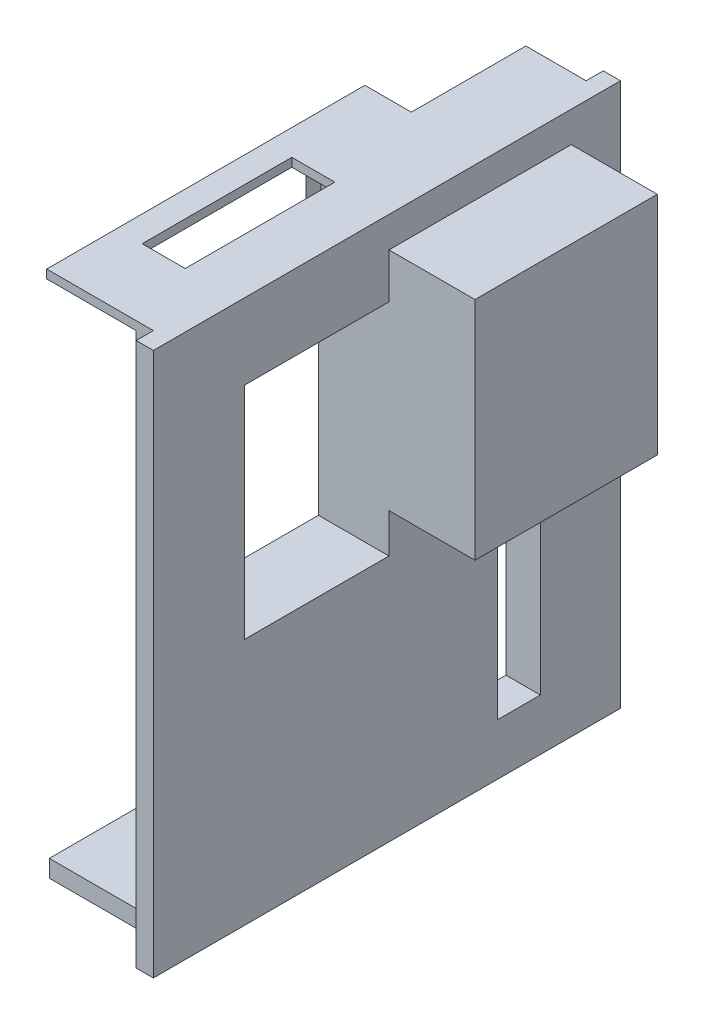
from build123d import *

# Parameters (mm, degrees)
SKETCH1_W            = 68.987924
SKETCH1_H            = 80.264
BOSS_EXTRUDE3_DEPTH  = 2.54
SKETCH1_7_W          = 63.907924
SKETCH1_7_H          = 77.724
BOSS_EXTRUDE4_DEPTH  = 2.54
SKETCH1_9_W          = 46.99
SKETCH1_9_H          = 1.27
BOSS_EXTRUDE6_DEPTH  = 15.748
SKETCH2_W            = 6.35
SKETCH2_H            = 22.098
CUT_EXTRUDE1_DEPTH   = 2.54
SKETCH3_W            = 16.917924
SKETCH3_H            = 1.27
BOSS_EXTRUDE7_DEPTH  = 6.35
SKETCH4_W            = 21.336
SKETCH4_H            = 32.512
CUT_EXTRUDE2_DEPTH   = 5.08
SKETCH5_W            = 25.4
SKETCH5_H            = 31.75
CUT_EXTRUDE3_DEPTH   = 5.08
SKETCH5_3_W          = 26.924
SKETCH5_3_H          = 33.34449199
SKETCH5_3_W_2        = 25.4
SKETCH5_3_H_2        = 31.75
BOSS_EXTRUDE8_DEPTH  = 12.7
BOSS_EXTRUDE9_START  = 12.7
SKETCH5_4_W          = 25.4
SKETCH5_4_H          = 31.75
BOSS_EXTRUDE9_DEPTH  = 1.27
SKETCH7_W            = 22.86
SKETCH7_H            = 34.036
SKETCH7_W_2          = 21.336
SKETCH7_H_2          = 32.512
BOSS_EXTRUDE10_DEPTH = 5.334
SKETCH6_W            = 6.35
SKETCH6_H            = 33.02
CUT_EXTRUDE5_DEPTH   = 5.334
SKETCH9_W            = 43.18
SKETCH9_H            = 2.54
BOSS_EXTRUDE12_DEPTH = 12.827
SKETCH10_W           = 2.54
SKETCH10_H           = 8.128
BOSS_EXTRUDE13_DEPTH = 32.258
BOSS_EXTRUDE14_DEPTH = 8.128


with BuildPart() as part:
    # Sketch1 → Boss-Extrude3 (new body)
    with BuildSketch(Plane(origin=(0, 0, 0), x_dir=(0, 0, -1), z_dir=(1, 0, 0))):
        with Locations((0.050038, -1.397)):
            Rectangle(SKETCH1_W, SKETCH1_H)
    extrude(amount=BOSS_EXTRUDE3_DEPTH)

    # Sketch1<7> → Boss-Extrude4 (add)
    with BuildSketch(Plane(origin=(0, 0, 0), x_dir=(0, 0, -1), z_dir=(1, 0, 0))):
        with Locations((0.050038, -0.127)):
            Rectangle(SKETCH1_7_W, SKETCH1_7_H)
    extrude(amount=-BOSS_EXTRUDE4_DEPTH)

    # Sketch1<9> → Boss-Extrude6 (add)
    with BuildSketch(Plane(origin=(0, 0, 0), x_dir=(0, 0, -1), z_dir=(1, 0, 0))):
        with Locations((-8.408924, 38.1)):
            Rectangle(SKETCH1_9_W, SKETCH1_9_H)
    extrude(amount=-BOSS_EXTRUDE6_DEPTH)

    # Sketch2 → Cut-Extrude1 (cut)
    with BuildSketch(Plane(origin=(0, 38.735, 0), x_dir=(1, 0, 0), z_dir=(0, 1, 0))):
        with Locations((-8.763, -10.567924)):
            Rectangle(SKETCH2_W, SKETCH2_H)
    extrude(amount=-CUT_EXTRUDE1_DEPTH, mode=Mode.SUBTRACT)

    # Sketch3 → Boss-Extrude7 (add)
    with BuildSketch(Plane.ZY.offset(2.54)):
        with Locations((-23.545038, 38.1)):
            Rectangle(SKETCH3_W, SKETCH3_H)
    extrude(amount=BOSS_EXTRUDE7_DEPTH)

    # Sketch4 → Cut-Extrude2 (cut)
    with BuildSketch(Plane(origin=(2.54, 0, 0), x_dir=(0, 0, -1), z_dir=(1, 0, 0))):
        with Locations((-10.313924, 11.303)):
            Rectangle(SKETCH4_W, SKETCH4_H)
    extrude(amount=-CUT_EXTRUDE2_DEPTH, mode=Mode.SUBTRACT)

    # Sketch5 → Cut-Extrude3 (cut)
    with BuildSketch(Plane(origin=(2.54, 0, 0), x_dir=(0, 0, -1), z_dir=(1, 0, 0))):
        with Locations((13.816076, 17.526)):
            Rectangle(SKETCH5_W, SKETCH5_H)
    extrude(amount=-CUT_EXTRUDE3_DEPTH, mode=Mode.SUBTRACT)

    # Sketch5<3> → Boss-Extrude8 (add)
    with BuildSketch(Plane(origin=(2.54, 0, 0), x_dir=(0, 0, -1), z_dir=(1, 0, 0))):
        with Locations((13.816076, 17.526)):
            Rectangle(SKETCH5_3_W, SKETCH5_3_H)
        with Locations((13.816076, 17.526)):
            Rectangle(SKETCH5_3_W_2, SKETCH5_3_H_2, mode=Mode.SUBTRACT)
    extrude(amount=BOSS_EXTRUDE8_DEPTH)

    # Sketch5<4> → Boss-Extrude9 (add)
    with BuildSketch(Plane(origin=(2.54, 0, 0), x_dir=(0, 0, -1), z_dir=(1, 0, 0)).offset(BOSS_EXTRUDE9_START)):
        with Locations((13.816076, 17.526)):
            Rectangle(SKETCH5_4_W, SKETCH5_4_H)
    extrude(amount=-BOSS_EXTRUDE9_DEPTH)

    # Sketch7 → Boss-Extrude10 (add)
    with BuildSketch(Plane.ZY.offset(2.54)):
        with Locations((10.313924, 11.303)):
            Rectangle(SKETCH7_W, SKETCH7_H)
        with Locations((10.313924, 11.303)):
            Rectangle(SKETCH7_W_2, SKETCH7_H_2, mode=Mode.SUBTRACT)
    extrude(amount=BOSS_EXTRUDE10_DEPTH)

    # Sketch6 → Cut-Extrude5 (cut)
    with BuildSketch(Plane.ZY.offset(2.54)):
        with Locations((-19.531076, -17.399)):
            Rectangle(SKETCH6_W, SKETCH6_H)
    extrude(amount=-CUT_EXTRUDE5_DEPTH, mode=Mode.SUBTRACT)

    # Sketch9 → Boss-Extrude12 (add)
    with BuildSketch(Plane.ZY.offset(2.54)):
        with Locations((10.313924, -37.719)):
            Rectangle(SKETCH9_W, SKETCH9_H)
    extrude(amount=BOSS_EXTRUDE12_DEPTH)

    # Sketch10 → Boss-Extrude13 (add)
    with BuildSketch(Plane.ZY.offset(-13.97)):
        with Locations((-12.444476, 27.686)):
            Rectangle(SKETCH10_W, SKETCH10_H)
    extrude(amount=BOSS_EXTRUDE13_DEPTH)

    # Sketch11 → Boss-Extrude14 (add)
    with BuildSketch(Plane(origin=(0, 31.75, 0), x_dir=(1, 0, 0), z_dir=(0, 1, 0))):
        with BuildLine():
            Line((-18.288, 13.714476), (-18.288, 8.951976))
            Line((-18.288, 8.951976), (-21.272654916, 12.682794645))
            ThreePointArc((-21.272654916, 12.682794645), (-21.349130777, 13.354550844), (-20.776803222, 13.714476))
            Line((-20.776803222, 13.714476), (-18.288, 13.714476))
        make_face()
    extrude(amount=-BOSS_EXTRUDE14_DEPTH)


solid = part.part
